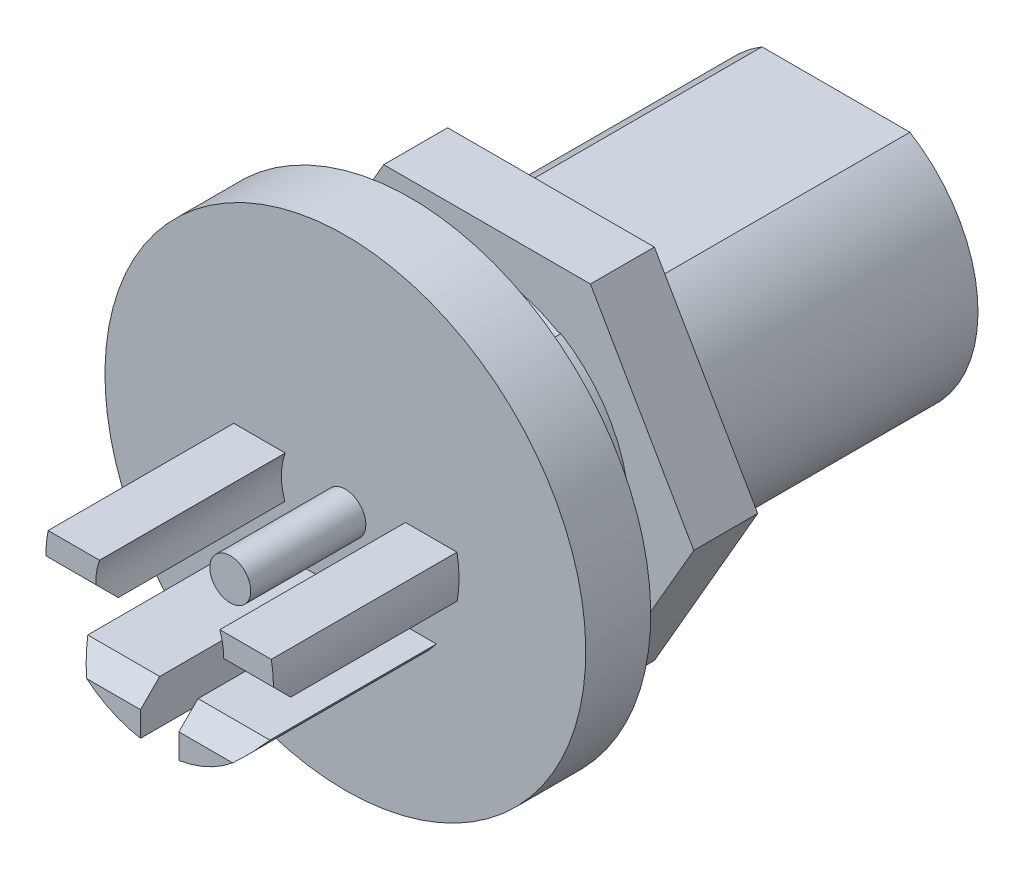
from build123d import *

# Parameters (mm, degrees)
SKETCH1_W           = 4.5
SKETCH1_H           = 0.8
BOSS_EXTRUDE1_DEPTH = 7.26
BOSS_EXTRUDE2_DEPTH = 7.26
CUT_EXTRUDE1_DEPTH  = 16.64
SKETCH4_R           = 0.79375
CHAMFER1_SIZE       = 0.75
BOSS_EXTRUDE3_START = 3
SKETCH5_R           = 5.5
BOSS_EXTRUDE3_DEPTH = 2.5


with BuildPart() as part:
    # Sketch1 → Revolve1 (revolve)
    with BuildSketch(Plane(origin=(0, 0, 0), x_dir=(0, 0, -1), z_dir=(1, 0, 0)), mode=Mode.PRIVATE) as revolve1_sk:
        Polygon((2.54, 8.65), (1.71, 8.65), (1.71, 6.85), (2.54, 6.85), (2.54, 5.55625), (19.18, 5.55625), (19.18, 4), (5, 4), (5, 0), (0, 0), (0, 9.4), (2.54, 9.4), align=None)
        with Locations((-2.25, 0.4)):
            Rectangle(SKETCH1_W, SKETCH1_H)
    revolve(revolve1_sk.sketch.rotate(Axis((0, 0, -7), (0, 0, -1)), 180), axis=Axis((0, 0, -7), (0, 0, -1)))

    # Sketch2 → Boss-Extrude1 (add)
    with BuildSketch(Plane.XY):
        with BuildLine():
            ThreePointArc((-4.362972037, 0.85), (-4.444927187, 0.02544207), (-4.37241638, -0.8))
            Line((-4.37241638, -0.8), (-2.368543856, -0.8))
            ThreePointArc((-2.368543856, -0.8), (-2.499859718, 0.026483767), (-2.351063589, 0.85))
            Line((-2.351063589, 0.85), (-4.362972037, 0.85))
        make_face()
        with BuildLine():
            ThreePointArc((2.5, 0), (2.466917068, -0.405364255), (2.368543856, -0.8))
            Line((2.368543856, -0.8), (4.37241638, -0.8))
            ThreePointArc((4.37241638, -0.8), (4.426816904, -0.401642995), (4.445, 0))
            ThreePointArc((4.445, 0), (4.424445485, 0.42697441), (4.362972037, 0.85))
            Line((4.362972037, 0.85), (2.351063589, 0.85))
            ThreePointArc((2.351063589, 0.85), (2.462484413, 0.431474812), (2.5, 0))
        make_face()
    extrude(amount=BOSS_EXTRUDE1_DEPTH)

    # Sketch2<3> → Boss-Extrude2 (add)
    with BuildSketch(Plane.XY):
        with BuildLine():
            Line((-0.75, -2.66), (-3.561239251, -2.66))
            ThreePointArc((-3.561239251, -2.66), (-2.321074836, -3.790862251), (-0.75, -4.381269793))
            Line((-0.75, -4.381269793), (-0.75, -2.66))
        make_face()
        with BuildLine():
            Line((0.75, -2.66), (0.75, -4.381269793))
            ThreePointArc((0.75, -4.381269793), (2.321074836, -3.790862251), (3.561239251, -2.66))
            Line((3.561239251, -2.66), (0.75, -2.66))
        make_face()
    extrude(amount=BOSS_EXTRUDE2_DEPTH)

    # Sketch3 → Cut-Extrude1 (cut)
    with BuildSketch(Plane(origin=(0, 0, -19.18), x_dir=(-1, 0, 0), z_dir=(0, 0, -1))):
        Polygon((-50.371435341, 4.74375), (-2.892879189, 4.74375), (2.892879189, 4.74375), (50.371435341, 4.74375), (50.371435341, 99.700862304), (-50.371435341, 99.700862304), align=None)
    extrude(amount=-CUT_EXTRUDE1_DEPTH, mode=Mode.SUBTRACT)

    # Chamfer1
    chamfer1_edges = [part.edges().sort_by_distance(p)[0] for p in [
        (-3.370480118, -0.8, 7.26),
        (3.370480118, -0.8, 7.26),
        (-2.155619625, -2.66, 7.26),
        (2.155619625, -2.66, 7.26),
    ]]
    chamfer(chamfer1_edges, length=CHAMFER1_SIZE)


with BuildPart() as body_2:
    # Sketch1<3> → Revolve2 (revolve)
    with BuildSketch(Plane(origin=(0, 0, 0), x_dir=(0, 0, -1), z_dir=(1, 0, 0)), mode=Mode.PRIVATE) as revolve2_sk:
        Polygon((5, 2), (5, 0), (7, 0), (7, 0.5), (17.18, 0.5), (17.18, 2), align=None)
    revolve(revolve2_sk.sketch.rotate(Axis((0, 0, -7), (0, 0, -1)), 180), axis=Axis((0, 0, -7), (0, 0, -1)))


    add(part.part)  # Boss-Extrude3 merges part
    # Sketch5 → Boss-Extrude3 (add)
    with BuildSketch(Plane(origin=(0, 0, -2.54), x_dir=(-1, 0, 0), z_dir=(0, 0, -1)).offset(BOSS_EXTRUDE3_START)):
        Polygon((4.041451884, 7), (-4.041451884, 7), (-8.082903769, 0), (-4.041451884, -7), (4.041451884, -7), (8.082903769, 0), align=None)
        Circle(SKETCH5_R, mode=Mode.SUBTRACT)
    extrude(amount=BOSS_EXTRUDE3_DEPTH)


with BuildPart() as body_3:
    # Sketch4 → Revolve3 (revolve)
    with BuildSketch(Plane(origin=(0, 0, 0), x_dir=(0, 0, -1), z_dir=(1, 0, 0)), mode=Mode.PRIVATE) as revolve3_sk:
        with Locations((2.50375, 7.75)):
            Circle(SKETCH4_R)
    revolve(revolve3_sk.sketch.rotate(Axis((0, 0, 0), (0, 0, -1)), 90), axis=Axis((0, 0, 0), (0, 0, -1)))


solid = Compound([body_2.part, body_3.part])
